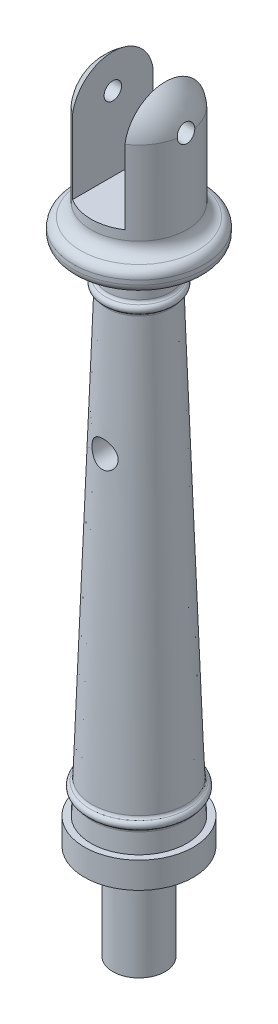
from build123d import *

# Parameters (mm, degrees)
FILLET1_R               = 0.75
SKETCH2_R               = 12.5
BOSS_EXTRUDE1_DEPTH     = 6
SKETCH3_R               = 6
BOSS_EXTRUDE2_DEPTH     = 22
SKETCH5_R               = 15
BOSS_EXTRUDE4_DEPTH     = 5
CUT_EXTRUDE2_START      = -15
CUT_EXTRUDE2_DEPTH      = 15
SKETCH9_R               = 11
BOSS_EXTRUDE6_DEPTH     = 22
FILLET2_R               = 2
FILLET3_R               = 3
CUT_EXTRUDE3_DEPTH      = 96.876689845
CUT_EXTRUDE3_DEPTH_BACK = 96.876689845
SKETCH11_W              = 12
SKETCH11_H              = 28
SKETCH13_R              = 3
CUT_EXTRUDE4_DEPTH      = 11
CUT_EXTRUDE5_DEPTH      = 95.205508005
CUT_EXTRUDE5_DEPTH_BACK = 95.205508005
SKETCH14_R              = 2


with BuildPart() as part:
    # Sketch1 → Revolve2 (revolve)
    with BuildSketch(Plane.XY):
        with BuildLine():
            Line((0, 57), (7, 57))
            Line((7, 57), (7.225257319, 50.58016642))
            ThreePointArc((7.225257319, 50.58016642), (7.355377934, 50.18359349), (7.677327074, 49.917980586))
            ThreePointArc((7.677327074, 49.917980586), (8.280086748, 49.03506614), (7.740692144, 48.112076106))
            ThreePointArc((7.740692144, 48.112076106), (7.438151346, 47.824551274), (7.33614619, 47.41983358))
            Line((7.33614619, 47.41983358), (10.754365294, -49.999410886))
            ThreePointArc((10.754365294, -49.999410886), (11.788816428, -50.963729739), (10.824497574, -51.998180873))
            Line((10.824497574, -51.998180873), (11, -57))
            Line((11, -57), (0, -57))
            Line((0, -57), (0, 57))
        make_face()
    revolve(axis=Axis((0, 57, 0), (0, -1, 0)))

    # Fillet1
    fillet1_edges = [part.edges().sort_by_distance(p)[0] for p in [
        (-10.824497574, -51.998180873, 0),
        (-10.754365294, -49.999410886, 0),
    ]]
    fillet(fillet1_edges, radius=FILLET1_R)

    # Sketch2 → Boss-Extrude1 (add)
    with BuildSketch(Plane.XZ.offset(57)):
        Circle(SKETCH2_R)
    extrude(amount=BOSS_EXTRUDE1_DEPTH)

    # Sketch3 → Boss-Extrude2 (add)
    with BuildSketch(Plane.XZ.offset(63)):
        Circle(SKETCH3_R)
    extrude(amount=BOSS_EXTRUDE2_DEPTH)

    # Sketch5 → Boss-Extrude4 (add)
    with BuildSketch(Plane(origin=(0, 57, 0), x_dir=(1, 0, 0), z_dir=(0, 1, 0))):
        Circle(SKETCH5_R)
    extrude(amount=BOSS_EXTRUDE4_DEPTH)

    # Sketch8 → Cut-Extrude2 (cut)
    with BuildSketch(Plane.XZ.offset(85).offset(CUT_EXTRUDE2_START)):
        with BuildLine():
            Line((-5, 3.31662479), (-5, -3.31662479))
            ThreePointArc((-5, -3.31662479), (-6, 0), (-5, 3.31662479))
        make_face()
    extrude(amount=CUT_EXTRUDE2_DEPTH, mode=Mode.SUBTRACT)

    # Sketch9 → Boss-Extrude6 (add)
    with BuildSketch(Plane(origin=(0, 62, 0), x_dir=(1, 0, 0), z_dir=(0, 1, 0))):
        Circle(SKETCH9_R)
    extrude(amount=BOSS_EXTRUDE6_DEPTH)

    # Fillet2
    fillet2_edges = [part.edges().sort_by_distance(p)[0] for p in [
        (-15, 57, 0),
        (-15, 62, 0),
    ]]
    fillet(fillet2_edges, radius=FILLET2_R)

    # Fillet3
    fillet3_edges = [part.edges().sort_by_distance(p)[0] for p in [
        (-11, 62, 0),
    ]]
    fillet(fillet3_edges, radius=FILLET3_R)

    # Sketch10 → Revolve3 (revolve)
    with BuildSketch(Plane.XY):
        with BuildLine():
            Line((11, 84), (0, 84))
            Line((0, 84), (0, 93.5))
            ThreePointArc((0, 93.5), (7.292505249, 90.825532394), (11, 84))
        make_face()
    revolve(axis=Axis((0, 84, 0), (0, 1, 0)))

    # Sketch11 → Cut-Extrude3 (cut, two sides: drawn at the far end of the back side and taken through both)
    with BuildSketch(Plane.XY.offset(-CUT_EXTRUDE3_DEPTH_BACK)):
        with Locations((0, 81)):
            Rectangle(SKETCH11_W, SKETCH11_H)
    extrude(amount=CUT_EXTRUDE3_DEPTH + CUT_EXTRUDE3_DEPTH_BACK, mode=Mode.SUBTRACT)

    # Sketch13 → Cut-Extrude4 (cut, symmetric)
    with BuildSketch(Plane.XY):
        with Locations((0, 19)):
            Circle(SKETCH13_R)
    extrude(amount=CUT_EXTRUDE4_DEPTH, both=True, mode=Mode.SUBTRACT)

    # Sketch14 → Cut-Extrude5 (cut, two sides: drawn at the far end of the back side and taken through both)
    with BuildSketch(Plane(origin=(0, 0, 0), x_dir=(0, 0, -1), z_dir=(1, 0, 0)).offset(-CUT_EXTRUDE5_DEPTH_BACK)):
        with Locations((0, 84)):
            Circle(SKETCH14_R)
    extrude(amount=CUT_EXTRUDE5_DEPTH + CUT_EXTRUDE5_DEPTH_BACK, mode=Mode.SUBTRACT)


solid = part.part
